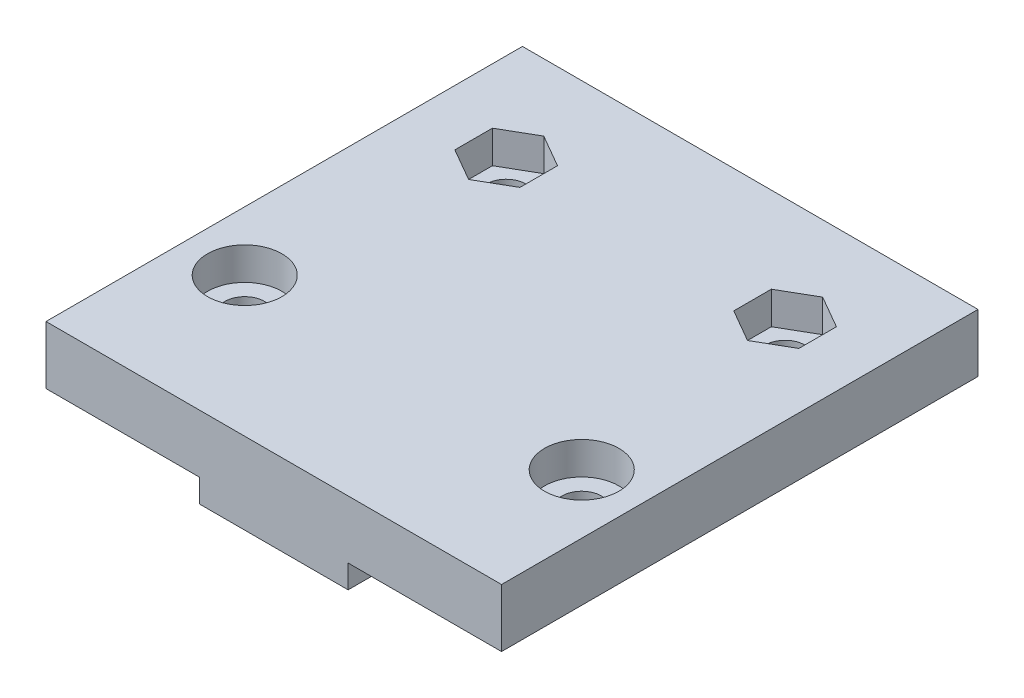
from build123d import *

# Parameters (mm, degrees)
SKETCH_1_W          = 40
SKETCH_1_H          = 20
EXTRUDE_1_DEPTH     = 6
SKETCH_2_W          = 40
SKETCH_2_H          = 32.5
EXTRUDE_2_DEPTH     = 35
CUT_EXTRUDE_1_DEPTH = 13
CUT_EXTRUDE_2_DEPTH = 2
SKETCH_6_W          = 40
SKETCH_6_H          = 41
CUT_EXTRUDE_3_DEPTH = 5
SKETCH_8_R          = 1.7
CUT_EXTRUDE_4_DEPTH = 49.79805324
SKETCH_9_W          = 40
SKETCH_9_H          = 12.5
SKETCH_9_H_2        = 8
CUT_EXTRUDE_5_DEPTH = 41
CUT_EXTRUDE_6_DEPTH = 2
SKETCH_11_R         = 3.2
CUT_EXTRUDE_7_DEPTH = 2.8
SKETCH_12_W         = 0.4
SKETCH_12_H         = 41
CUT_EXTRUDE_8_DEPTH = 5


with BuildPart() as part:
    # Эскиз1 → Бобышка-Вытянуть1 (new body)
    with BuildSketch(Plane.XY):
        Rectangle(SKETCH_1_W, SKETCH_1_H)
    extrude(amount=EXTRUDE_1_DEPTH)

    # Эскиз2 → Бобышка-Вытянуть2 (add)
    with BuildSketch(Plane(origin=(0, 0, 0), x_dir=(-1, 0, 0), z_dir=(0, 0, -1))):
        with Locations((0, 6.25)):
            Rectangle(SKETCH_2_W, SKETCH_2_H)
    extrude(amount=EXTRUDE_2_DEPTH)

    # Эскиз3 → Вырез-Вытянуть1 (cut)
    with BuildSketch(Plane.XZ.offset(10)):
        Polygon((-7, 6), (-7, -1), (-9, -1), (-9, -23), (-6.5, -26), (-6.5, -33), (-4.5, -33), (-4.5, -35), (4.5, -35), (4.5, -33), (6.5, -33), (6.5, -26), (9, -23), (9, -1), (7, -1), (7, 6), align=None)
    extrude(amount=-CUT_EXTRUDE_1_DEPTH, mode=Mode.SUBTRACT)

    # Эскиз5 → Вырез-Вытянуть2 (cut)
    with BuildSketch(Plane.XZ.offset(-3)):
        Polygon((-9, -1), (9, -1), (9, -23), (6.5, -26), (6.5, -33), (-6.5, -33), (-6.5, -26), (-9, -23), align=None)
    extrude(amount=-CUT_EXTRUDE_2_DEPTH, mode=Mode.SUBTRACT)

    # Эскиз6 → Вырез-Вытянуть3 (cut)
    with BuildSketch(Plane.XZ.offset(10)):
        with Locations((0, -14.5)):
            Rectangle(SKETCH_6_W, SKETCH_6_H)
    extrude(amount=-CUT_EXTRUDE_3_DEPTH, mode=Mode.SUBTRACT)

    # Эскиз8 → Вырез-Вытянуть4 (cut, through all)
    with BuildSketch(Plane.XZ.offset(5)):
        with Locations((12, -26)):
            Circle(SKETCH_8_R)
        with Locations((14.5, -6)):
            Circle(SKETCH_8_R)
        with Locations(Location((-12, -26, 0), (0, 0, 180))):
            Circle(SKETCH_8_R)
        with Locations(Location((-14.5, -6, 0), (0, 0, 180))):
            Circle(SKETCH_8_R)
    extrude(amount=-CUT_EXTRUDE_4_DEPTH, mode=Mode.SUBTRACT)

    # Эскиз9 → Вырез-Вытянуть5 (cut)
    with BuildSketch(Plane.XY.offset(6)):
        with Locations((0, 16.25)):
            Rectangle(SKETCH_9_W, SKETCH_9_H)
        with Locations((0, -1)):
            Rectangle(SKETCH_9_W, SKETCH_9_H_2)
    extrude(amount=-CUT_EXTRUDE_5_DEPTH, mode=Mode.SUBTRACT)

    # Эскиз10 → Вырез-Вытянуть6 (cut)
    with BuildSketch(Plane.XZ.offset(-3)):
        Polygon((-20, 6), (-6.4, 6), (-6.4, -1), (-4, -33), (-4, -35), (-20, -35), align=None)
    cut_extrude_6 = extrude(amount=-CUT_EXTRUDE_6_DEPTH, mode=Mode.SUBTRACT)

    # Зеркальное отражение1: Вырез-Вытянуть6 across plane
    add(cut_extrude_6.mirror(Plane(origin=(0, 0, 0), x_dir=(0, 0, 1), z_dir=(1, 0, 0))), mode=Mode.SUBTRACT)

    # Эскиз11 → Вырез-Вытянуть7 (cut)
    with BuildSketch(Plane(origin=(0, 10, 0), x_dir=(1, 0, 0), z_dir=(0, 1, 0))):
        with Locations(Location((14.5, 6, 0), (0, 0, 180))):
            Circle(SKETCH_11_R)
        with Locations((-14.5, 6)):
            Circle(SKETCH_11_R)
        Polygon((-12, 29.233161507), (-14.8, 27.616580754), (-14.8, 24.383419246), (-12, 22.766838493), (-9.2, 24.383419246), (-9.2, 27.616580754), align=None)
        Polygon((9.2, 27.616580754), (12, 29.233161507), (14.8, 27.616580754), (14.8, 24.383419246), (12, 22.766838493), (9.2, 24.383419246), align=None)
    extrude(amount=-CUT_EXTRUDE_7_DEPTH, mode=Mode.SUBTRACT)

    # Эскиз12 → Вырез-Вытянуть8 (cut)
    with BuildSketch(Plane(origin=(0, 10, 0), x_dir=(1, 0, 0), z_dir=(0, 1, 0))):
        with Locations((-19.8, 14.5)):
            Rectangle(SKETCH_12_W, SKETCH_12_H)
        with Locations((19.8, 14.5)):
            Rectangle(SKETCH_12_W, SKETCH_12_H)
    extrude(amount=-CUT_EXTRUDE_8_DEPTH, mode=Mode.SUBTRACT)


solid = part.part
